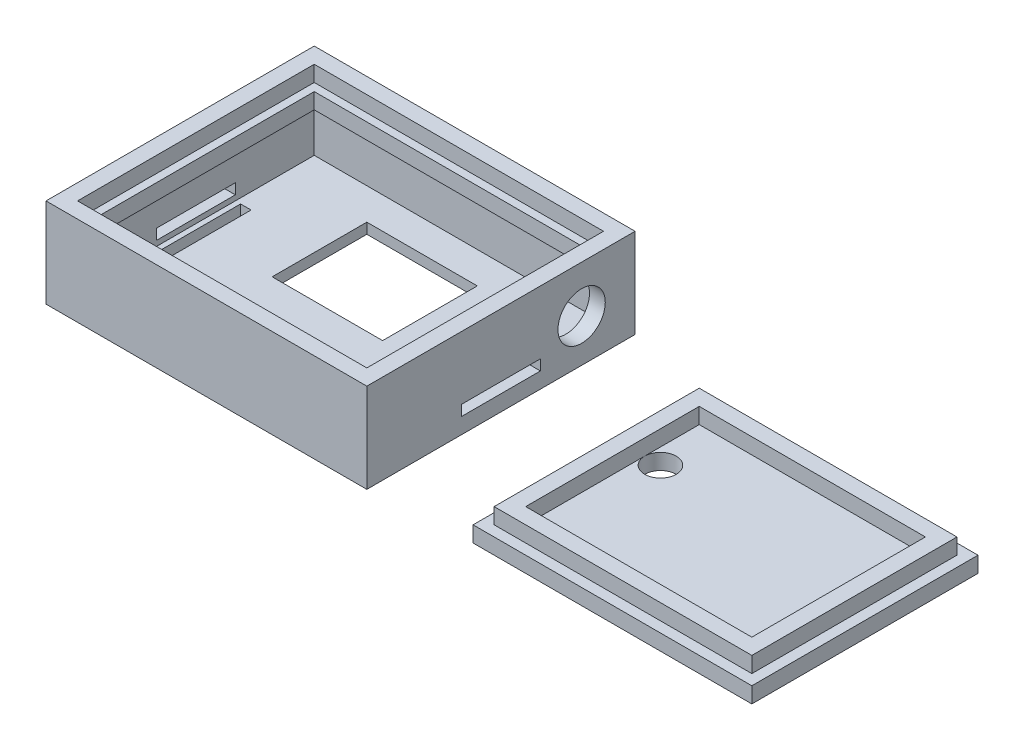
from build123d import *
from build123d.topology import SkipClean

# Parameters (mm, degrees)
SKETCH1_W           = 61
SKETCH1_H           = 51
BOSS_EXTRUDE1_DEPTH = 18
SKETCH2_W           = 55
SKETCH2_H           = 45
CUT_EXTRUDE1_DEPTH  = 15
SKETCH4_W           = 45
SKETCH4_H           = 3
BOSS_EXTRUDE3_DEPTH = 55
SKETCH5_W           = 49
SKETCH5_H           = 39
CUT_EXTRUDE2_DEPTH  = 3
SKETCH6_W           = 21
SKETCH6_H           = 18
CUT_EXTRUDE3_DEPTH  = 3
SKETCH7_W           = 15
SKETCH7_H           = 2
CUT_EXTRUDE5_DEPTH  = 61
SKETCH8_W           = 2
SKETCH8_H           = 15
CUT_EXTRUDE6_DEPTH  = 3
SKETCH9_W           = 2
SKETCH9_H           = 15
CUT_EXTRUDE7_DEPTH  = 3
SKETCH10_R          = 4.5
CUT_EXTRUDE8_DEPTH  = 6
SKETCH11_W          = 55
SKETCH11_H          = 45
BOSS_EXTRUDE4_DEPTH = 3
SKETCH12_W          = 49
SKETCH12_H          = 39
BOSS_EXTRUDE5_DEPTH = 3
SKETCH13_W          = 43
SKETCH13_H          = 33
CUT_EXTRUDE9_DEPTH  = 3
CUT_EXTRUDE11_DEPTH = 3
SKETCH20_W          = 61
SKETCH20_H          = 1
CUT_EXTRUDE12_DEPTH = 51
SKETCH23_R          = 3
CUT_EXTRUDE13_DEPTH = 10
SKETCH24_W          = 55
SKETCH24_H          = 3
BOSS_EXTRUDE6_DEPTH = 25
SKETCH25_W          = 45
SKETCH25_H          = 3
CUT_EXTRUDE15_DEPTH = 1
SKETCH26_W          = 45
SKETCH26_H          = 3
CUT_EXTRUDE16_DEPTH = 1
SKETCH27_W          = 53
SKETCH27_H          = 3
CUT_EXTRUDE17_DEPTH = 1
SKETCH28_W          = 53
SKETCH28_H          = 3
CUT_EXTRUDE18_DEPTH = 1
SKETCH30_W          = 39
SKETCH30_H          = 3
CUT_EXTRUDE23_DEPTH = 1.5
SKETCH35_W          = 39
SKETCH35_H          = 3
CUT_EXTRUDE24_DEPTH = 1.5
SKETCH36_W          = 52
SKETCH36_H          = 3
CUT_EXTRUDE25_DEPTH = 1.5
SKETCH38_W          = 52
SKETCH38_H          = 3
CUT_EXTRUDE26_DEPTH = 1.5


with BuildPart() as part:
    # Sketch1 → Boss-Extrude1 (new body)
    with BuildSketch(Plane(origin=(0, 0, 0), x_dir=(1, 0, 0), z_dir=(0, 1, 0))):
        with Locations((31.566767905, 25.233308024)):
            Rectangle(SKETCH1_W, SKETCH1_H)
    extrude(amount=BOSS_EXTRUDE1_DEPTH)

    # Sketch2 → Cut-Extrude1 (cut)
    with BuildSketch(Plane(origin=(0, 18, 0), x_dir=(1, 0, 0), z_dir=(0, 1, 0))):
        with Locations((31.566767905, 25.233308024)):
            Rectangle(SKETCH2_W, SKETCH2_H)
    extrude(amount=-CUT_EXTRUDE1_DEPTH, mode=Mode.SUBTRACT)

    # Sketch4 → Boss-Extrude3 (add)
    with BuildSketch(Plane.ZY.offset(-59.066767905)):
        with Locations((-25.233308024, 13.5)):
            Rectangle(SKETCH4_W, SKETCH4_H)
    extrude(amount=BOSS_EXTRUDE3_DEPTH)

    # Sketch5 → Cut-Extrude2 (cut)
    with BuildSketch(Plane(origin=(0, 15, 0), x_dir=(1, 0, 0), z_dir=(0, 1, 0))):
        with Locations((31.566767905, 25.233308024)):
            Rectangle(SKETCH5_W, SKETCH5_H)
    extrude(amount=-CUT_EXTRUDE2_DEPTH, mode=Mode.SUBTRACT)

    # Sketch6 → Cut-Extrude3 (cut)
    with BuildSketch(Plane(origin=(0, 3, 0), x_dir=(1, 0, 0), z_dir=(0, 1, 0))):
        with Locations((30.566767905, 32.733308024)):
            Rectangle(SKETCH6_W, SKETCH6_H)
    extrude(amount=-CUT_EXTRUDE3_DEPTH, mode=Mode.SUBTRACT)

    # Sketch7 → Cut-Extrude5 (cut)
    with BuildSketch(Plane.ZY.offset(-1.066767905)):
        with Locations((-25.233308024, 5)):
            Rectangle(SKETCH7_W, SKETCH7_H)
    extrude(amount=-CUT_EXTRUDE5_DEPTH, mode=Mode.SUBTRACT)

    # Sketch8 → Cut-Extrude6 (cut)
    with BuildSketch(Plane(origin=(0, 0, 0), x_dir=(-1, 0, 0), z_dir=(0, -1, 0))):
        with Locations((-6.066767905, 25.233308024)):
            Rectangle(SKETCH8_W, SKETCH8_H)
    extrude(amount=-CUT_EXTRUDE6_DEPTH, mode=Mode.SUBTRACT)

    # Sketch9 → Cut-Extrude7 (cut)
    with BuildSketch(Plane(origin=(0, 0, 0), x_dir=(-1, 0, 0), z_dir=(0, -1, 0))):
        with Locations((-57.066767905, 25.233308024)):
            Rectangle(SKETCH9_W, SKETCH9_H)
    extrude(amount=-CUT_EXTRUDE7_DEPTH, mode=Mode.SUBTRACT)

    # Sketch10 → Cut-Extrude8 (cut)
    with BuildSketch(Plane(origin=(62.066767905, 0, 0), x_dir=(0, 0, -1), z_dir=(1, 0, 0))):
        with Locations((40.568087222, 9.131757494)):
            Circle(SKETCH10_R)
    extrude(amount=-CUT_EXTRUDE8_DEPTH, mode=Mode.SUBTRACT)

    # Sketch20 → Cut-Extrude12 (cut)
    with BuildSketch(Plane.XY.offset(0.266691976)):
        with Locations((31.566767905, 0.5)):
            Rectangle(SKETCH20_W, SKETCH20_H)
    extrude(amount=-CUT_EXTRUDE12_DEPTH, mode=Mode.SUBTRACT)


with BuildPart() as body_2:
    # Sketch11 → Boss-Extrude4 (new body)
    with BuildSketch(Plane(origin=(0, 0, 0), x_dir=(-1, 0, 0), z_dir=(0, -1, 0))):
        with Locations((-107.5, 22.5)):
            Rectangle(SKETCH11_W, SKETCH11_H)
    extrude(amount=-BOSS_EXTRUDE4_DEPTH)

    # Sketch12 → Boss-Extrude5 (add)
    with BuildSketch(Plane(origin=(0, 3, 0), x_dir=(1, 0, 0), z_dir=(0, 1, 0))):
        with Locations((107.5, 22.5)):
            Rectangle(SKETCH12_W, SKETCH12_H)
    extrude(amount=BOSS_EXTRUDE5_DEPTH)

    # Sketch13 → Cut-Extrude9 (cut)
    with BuildSketch(Plane(origin=(0, 6, 0), x_dir=(1, 0, 0), z_dir=(0, 1, 0))):
        with Locations((107.5, 22.5)):
            Rectangle(SKETCH13_W, SKETCH13_H)
    extrude(amount=-CUT_EXTRUDE9_DEPTH, mode=Mode.SUBTRACT)

    # Sketch15 → Cut-Extrude11 (cut)
    with BuildSketch(Plane(origin=(0, 3, 0), x_dir=(1, 0, 0), z_dir=(0, 1, 0))):
        with BuildLine():
            ThreePointArc((86.878679656, 13.878679656), (87.851949703, 13.228361402), (89, 13))
            ThreePointArc((89, 13), (91.121320344, 13.878679656), (92, 16))
            ThreePointArc((92, 16), (91.771638598, 17.148050297), (91.121320344, 18.121320344))
            Line((91.121320344, 18.121320344), (86.878679656, 13.878679656))
        make_face()
        with BuildLine():
            ThreePointArc((91.121320344, 18.121320344), (86.878679656, 18.121320344), (86.878679656, 13.878679656))
            Line((86.878679656, 13.878679656), (91.121320344, 18.121320344))
        make_face()
    extrude(amount=-CUT_EXTRUDE11_DEPTH, mode=Mode.SUBTRACT)

    # Sketch23 → Cut-Extrude13 (cut)
    with BuildSketch(Plane(origin=(0, 3, 0), x_dir=(1, 0, 0), z_dir=(0, 1, 0))):
        with Locations(Location((89, 28.625530176, 0), (0, 0, 180))):
            Circle(SKETCH23_R)
    extrude(amount=-CUT_EXTRUDE13_DEPTH, mode=Mode.SUBTRACT)

    # Sketch24 → Boss-Extrude6 (add)
    with SkipClean():  # the faces are left unmerged after this step: merging them gives an invalid solid
        with BuildSketch(Plane.XY):
            with Locations((107.5, 1.5)):
                Rectangle(SKETCH24_W, SKETCH24_H)
        extrude(amount=-BOSS_EXTRUDE6_DEPTH)

    # Sketch25 → Cut-Extrude15 (cut)
    with SkipClean():  # the faces are left unmerged after this step: merging them gives an invalid solid
        with BuildSketch(Plane.ZY.offset(-80)):
            with Locations((-22.5, 1.5)):
                Rectangle(SKETCH25_W, SKETCH25_H)
        extrude(amount=-CUT_EXTRUDE15_DEPTH, mode=Mode.SUBTRACT)

    # Sketch26 → Cut-Extrude16 (cut)
    with SkipClean():  # the faces are left unmerged after this step: merging them gives an invalid solid
        with BuildSketch(Plane(origin=(135, 0, 0), x_dir=(0, 0, -1), z_dir=(1, 0, 0))):
            with Locations((22.5, 1.5)):
                Rectangle(SKETCH26_W, SKETCH26_H)
        extrude(amount=-CUT_EXTRUDE16_DEPTH, mode=Mode.SUBTRACT)

    # Sketch27 → Cut-Extrude17 (cut)
    with SkipClean():  # the faces are left unmerged after this step: merging them gives an invalid solid
        with BuildSketch(Plane(origin=(0, 0, -45), x_dir=(-1, 0, 0), z_dir=(0, 0, -1))):
            with Locations((-107.5, 1.5)):
                Rectangle(SKETCH27_W, SKETCH27_H)
        extrude(amount=-CUT_EXTRUDE17_DEPTH, mode=Mode.SUBTRACT)

    # Sketch28 → Cut-Extrude18 (cut)
    with SkipClean():  # the faces are left unmerged after this step: merging them gives an invalid solid
        with BuildSketch(Plane.XY):
            with Locations((107.5, 1.5)):
                Rectangle(SKETCH28_W, SKETCH28_H)
        extrude(amount=-CUT_EXTRUDE18_DEPTH, mode=Mode.SUBTRACT)


with BuildPart() as part_1:
    # Body-Move/Copy1: moved
    add(part.part.moved(Location((0, -1, 0))))

    # Sketch30 → Cut-Extrude23 (cut)
    with BuildSketch(Plane(origin=(7.066767905, 0, 0), x_dir=(0, 0, -1), z_dir=(1, 0, 0))):
        with Locations((25.233308024, 12.5)):
            Rectangle(SKETCH30_W, SKETCH30_H)
    extrude(amount=-CUT_EXTRUDE23_DEPTH, mode=Mode.SUBTRACT)

    # Sketch35 → Cut-Extrude24 (cut)
    with BuildSketch(Plane.ZY.offset(-56.066767905)):
        with Locations((-25.233308024, 12.5)):
            Rectangle(SKETCH35_W, SKETCH35_H)
    extrude(amount=-CUT_EXTRUDE24_DEPTH, mode=Mode.SUBTRACT)

    # Sketch36 → Cut-Extrude25 (cut)
    with BuildSketch(Plane(origin=(0, 0, -5.733308024), x_dir=(-1, 0, 0), z_dir=(0, 0, -1))):
        with Locations((-31.566767905, 12.5)):
            Rectangle(SKETCH36_W, SKETCH36_H)
    extrude(amount=-CUT_EXTRUDE25_DEPTH, mode=Mode.SUBTRACT)

    # Sketch38 → Cut-Extrude26 (cut)
    with BuildSketch(Plane.XY.offset(-44.733308024)):
        with Locations((31.566767905, 12.5)):
            Rectangle(SKETCH38_W, SKETCH38_H)
    extrude(amount=-CUT_EXTRUDE26_DEPTH, mode=Mode.SUBTRACT)


solid = Compound([body_2.part, part_1.part])
